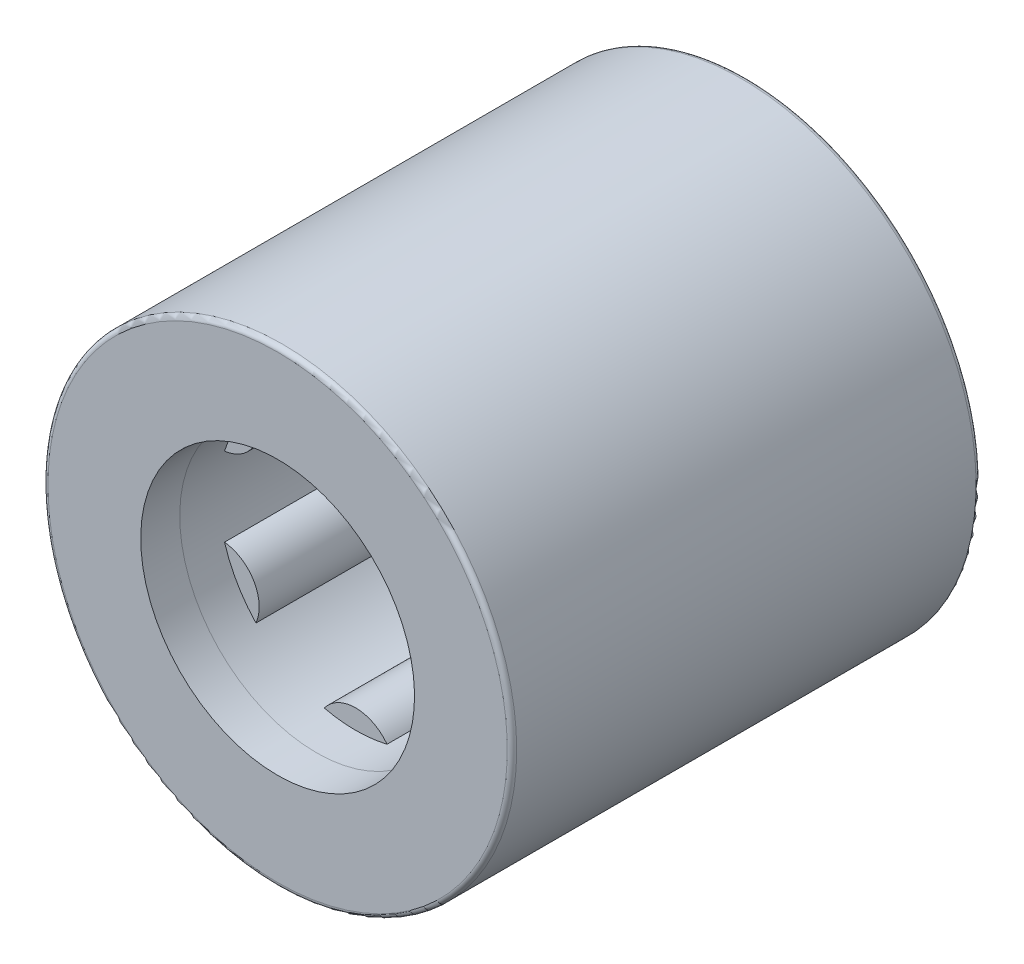
from build123d import *

# Parameters (mm, degrees)
SKETCH2_W           = 8.006666666
SKETCH2_H           = 0.74875
SKETCH3_W           = 10.003333334
SKETCH3_H           = 0.249583334
CIRPATTERN1_COUNT   = 6
CIRPATTERN1_ANGLE   = 300
FILLET1_R           = 0.12
SKETCH5_R           = 5.101666667
SKETCH5_R_2         = 3.504166667
BOSS_EXTRUDE1_DEPTH = 10.003333333
SKETCH2_4_W         = 8.006666666
SKETCH2_4_H         = 0.74875
CIRPATTERN2_COUNT   = 6


with BuildPart() as part:
    # Sketch1 → Revolve1 (revolve)
    with BuildSketch(Plane(origin=(0, 0, 0), x_dir=(0, 0, -1), z_dir=(1, 0, 0)), mode=Mode.PRIVATE) as revolve1_sk:
        Polygon((-6, 6), (6, 6), (6, 3.504166667), (5.001666667, 3.504166667), (5.001666667, 5.001666667), (-5.001666667, 5.001666667), (-5.001666667, 3.504166667), (-6, 3.504166667), align=None)
    revolve(revolve1_sk.sketch.rotate(Axis((0, 0, 6), (0, 0, -1)), 180), axis=Axis((0, 0, 6), (0, 0, -1)))

    # Fillet1
    fillet1_edges = [part.edges().sort_by_distance(p)[0] for p in [
        (0, 6, 6),
        (0, 6, -6),
    ]]
    fillet(fillet1_edges, radius=FILLET1_R)


with BuildPart() as body_2:
    # Sketch2 → Revolve2 (revolve)
    with BuildSketch(Plane(origin=(0, 0, 0), x_dir=(0, 0, -1), z_dir=(1, 0, 0)), mode=Mode.PRIVATE) as revolve2_sk:
        with Locations((0, 4.627291667)):
            Rectangle(SKETCH2_W, SKETCH2_H)
    revolve(revolve2_sk.sketch.rotate(Axis((0, 4.003333333, 4.003333333), (0, 0, -1)), 90), axis=Axis((0, 4.003333333, 4.003333333), (0, 0, -1)))


with BuildPart() as body_3:
    # Sketch3 → Revolve3 (revolve)
    with BuildSketch(Plane(origin=(0, 0, 0), x_dir=(0, 0, -1), z_dir=(1, 0, 0)), mode=Mode.PRIVATE) as revolve3_sk:
        with Locations((0, 4.128125)):
            Rectangle(SKETCH3_W, SKETCH3_H)
    revolve(revolve3_sk.sketch.rotate(Axis((0, 4.003333333, 5.001666667), (0, 0, -1)), 180), axis=Axis((0, 4.003333333, 5.001666667), (0, 0, -1)))


with BuildPart() as cirpattern1_1:
    # CirPattern1: pattern copy
    add(body_3.part.rotate(Axis((0, 0, -6), (0, 0, 1)), 1 * CIRPATTERN1_ANGLE / (CIRPATTERN1_COUNT - 1)))


with BuildPart() as cirpattern1_2:
    # CirPattern1: pattern copy
    add(body_3.part.rotate(Axis((0, 0, -6), (0, 0, 1)), 2 * CIRPATTERN1_ANGLE / (CIRPATTERN1_COUNT - 1)))


with BuildPart() as cirpattern1_3:
    # CirPattern1: pattern copy
    add(body_3.part.rotate(Axis((0, 0, -6), (0, 0, 1)), 3 * CIRPATTERN1_ANGLE / (CIRPATTERN1_COUNT - 1)))


with BuildPart() as cirpattern1_4:
    # CirPattern1: pattern copy
    add(body_3.part.rotate(Axis((0, 0, -6), (0, 0, 1)), 4 * CIRPATTERN1_ANGLE / (CIRPATTERN1_COUNT - 1)))


with BuildPart() as cirpattern1_5:
    # CirPattern1: pattern copy
    add(body_3.part.rotate(Axis((0, 0, -6), (0, 0, 1)), 5 * CIRPATTERN1_ANGLE / (CIRPATTERN1_COUNT - 1)))


with BuildPart() as cirpattern1_6:
    # CirPattern1: pattern copy
    add(body_2.part.rotate(Axis((0, 0, -6), (0, 0, 1)), 1 * CIRPATTERN1_ANGLE / (CIRPATTERN1_COUNT - 1)))


with BuildPart() as cirpattern1_7:
    # CirPattern1: pattern copy
    add(body_2.part.rotate(Axis((0, 0, -6), (0, 0, 1)), 2 * CIRPATTERN1_ANGLE / (CIRPATTERN1_COUNT - 1)))


with BuildPart() as cirpattern1_8:
    # CirPattern1: pattern copy
    add(body_2.part.rotate(Axis((0, 0, -6), (0, 0, 1)), 3 * CIRPATTERN1_ANGLE / (CIRPATTERN1_COUNT - 1)))


with BuildPart() as cirpattern1_9:
    # CirPattern1: pattern copy
    add(body_2.part.rotate(Axis((0, 0, -6), (0, 0, 1)), 4 * CIRPATTERN1_ANGLE / (CIRPATTERN1_COUNT - 1)))


with BuildPart() as cirpattern1_10:
    # CirPattern1: pattern copy
    add(body_2.part.rotate(Axis((0, 0, -6), (0, 0, 1)), 5 * CIRPATTERN1_ANGLE / (CIRPATTERN1_COUNT - 1)))


with BuildPart() as body_14:
    # Sketch5 → Boss-Extrude1 (new body)
    with BuildSketch(Plane.XY.offset(-5.001666667)):
        with Locations(Location((0, 0, 0), (0, 0, 270))):
            Circle(SKETCH5_R)
        with Locations(Location((0, 0, 0), (0, 0, 270))):
            Circle(SKETCH5_R_2, mode=Mode.SUBTRACT)
    extrude(amount=BOSS_EXTRUDE1_DEPTH)

    # Sketch2<4> → Cut-Revolve3 (revolve, cut)
    with BuildSketch(Plane(origin=(0, 0, 0), x_dir=(0, 0, -1), z_dir=(1, 0, 0))):
        with Locations((0, 4.627291667)):
            Rectangle(SKETCH2_4_W, SKETCH2_4_H)
    cut_revolve3 = revolve(axis=Axis((0, 4.003333333, 4.003333333), (0, 0, -1)), mode=Mode.SUBTRACT)

    # CirPattern2: Cut-Revolve3 ×6 about axis
    cirpattern2_axis = Axis((0, 0, 0), (0, 0, 1))
    for i in range(1, CIRPATTERN2_COUNT):
        add(cut_revolve3.rotate(cirpattern2_axis, i * 360 / CIRPATTERN2_COUNT), mode=Mode.SUBTRACT)


solid = Compound([part.part, body_2.part, body_3.part, cirpattern1_1.part, cirpattern1_2.part, cirpattern1_3.part, cirpattern1_4.part, cirpattern1_5.part, cirpattern1_6.part, cirpattern1_7.part, cirpattern1_8.part, cirpattern1_9.part, cirpattern1_10.part, body_14.part])
